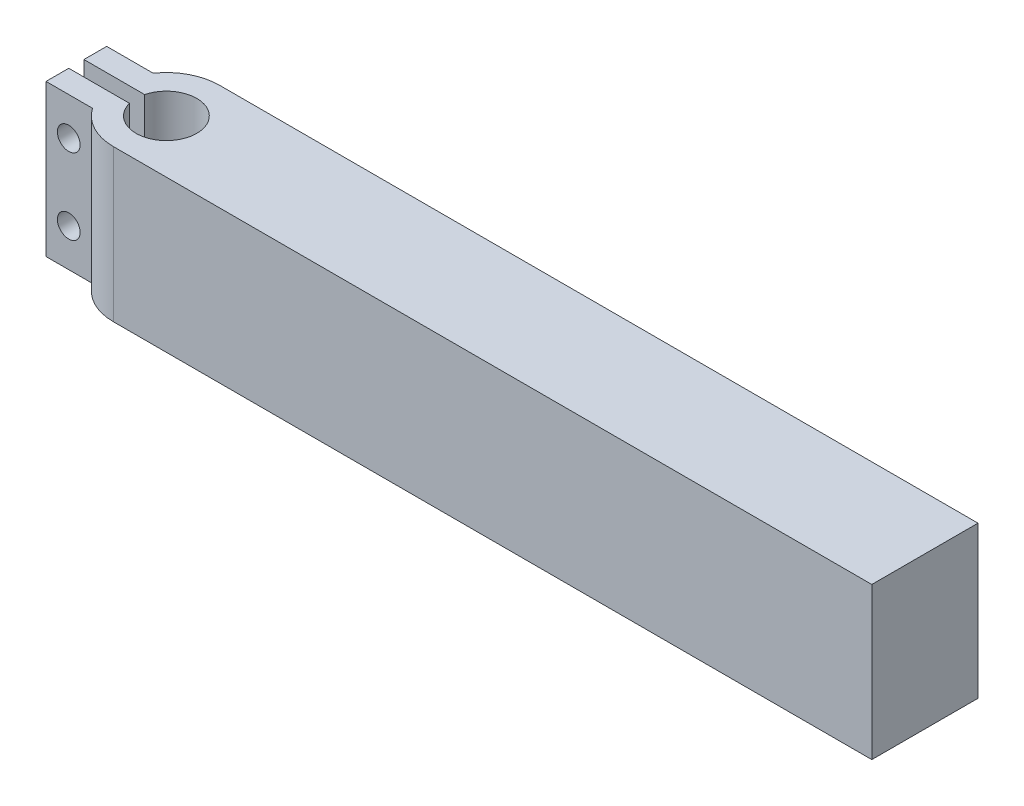
from build123d import *

# Parameters (mm, degrees)
ESBO_O1_R                = 7
ESBO_O1_W                = 100
ESBO_O1_H                = 14
RESSALTO_EXTRUS_O1_DEPTH = 20
ESBO_O2_R                = 4
CORTE_EXTRUS_O1_DEPTH    = 20
ESBO_O3_W                = 10
ESBO_O3_H                = 2
CORTE_EXTRUS_O2_DEPTH    = 20
ESBO_O4_W                = 8
ESBO_O4_H                = 3
RESSALTO_EXTRUS_O2_DEPTH = 20
ESBO_O5_R                = 1.5
CORTE_EXTRUS_O3_DEPTH    = 20


with BuildPart() as part:
    # Esboço1 → Ressalto-extrusão1 (new body)
    with BuildSketch(Plane(origin=(0, 0, 0), x_dir=(1, 0, 0), z_dir=(0, 1, 0))):
        with Locations((0, 7)):
            Circle(ESBO_O1_R)
        with Locations((50, 7)):
            Rectangle(ESBO_O1_W, ESBO_O1_H)
    extrude(amount=RESSALTO_EXTRUS_O1_DEPTH)

    # Esboço2 → Corte-extrusão1 (cut)
    with BuildSketch(Plane(origin=(0, 20, 0), x_dir=(1, 0, 0), z_dir=(0, 1, 0))):
        with Locations(Location((0, 7, 0), (0, 0, 270))):
            Circle(ESBO_O2_R)
    extrude(amount=-CORTE_EXTRUS_O1_DEPTH, mode=Mode.SUBTRACT)

    # Esboço3 → Corte-extrusão2 (cut)
    with BuildSketch(Plane(origin=(0, 20, 0), x_dir=(1, 0, 0), z_dir=(0, 1, 0))):
        with Locations((-4, 7)):
            Rectangle(ESBO_O3_W, ESBO_O3_H)
    extrude(amount=-CORTE_EXTRUS_O2_DEPTH, mode=Mode.SUBTRACT)

    # Esboço4 → Ressalto-extrusão2 (add)
    with BuildSketch(Plane(origin=(0, 20, 0), x_dir=(1, 0, 0), z_dir=(0, 1, 0))):
        with Locations((-7.872983346, 9.5)):
            Rectangle(ESBO_O4_W, ESBO_O4_H)
        with Locations((-7.872983346, 4.5)):
            Rectangle(ESBO_O4_W, ESBO_O4_H)
    extrude(amount=-RESSALTO_EXTRUS_O2_DEPTH)

    # Esboço5 → Corte-extrusão3 (cut)
    with BuildSketch(Plane.XY.offset(-3)):
        with Locations((-8.872983346, 15)):
            Circle(ESBO_O5_R)
        with Locations((-8.872983346, 5)):
            Circle(ESBO_O5_R)
    extrude(amount=-CORTE_EXTRUS_O3_DEPTH, mode=Mode.SUBTRACT)


solid = part.part
